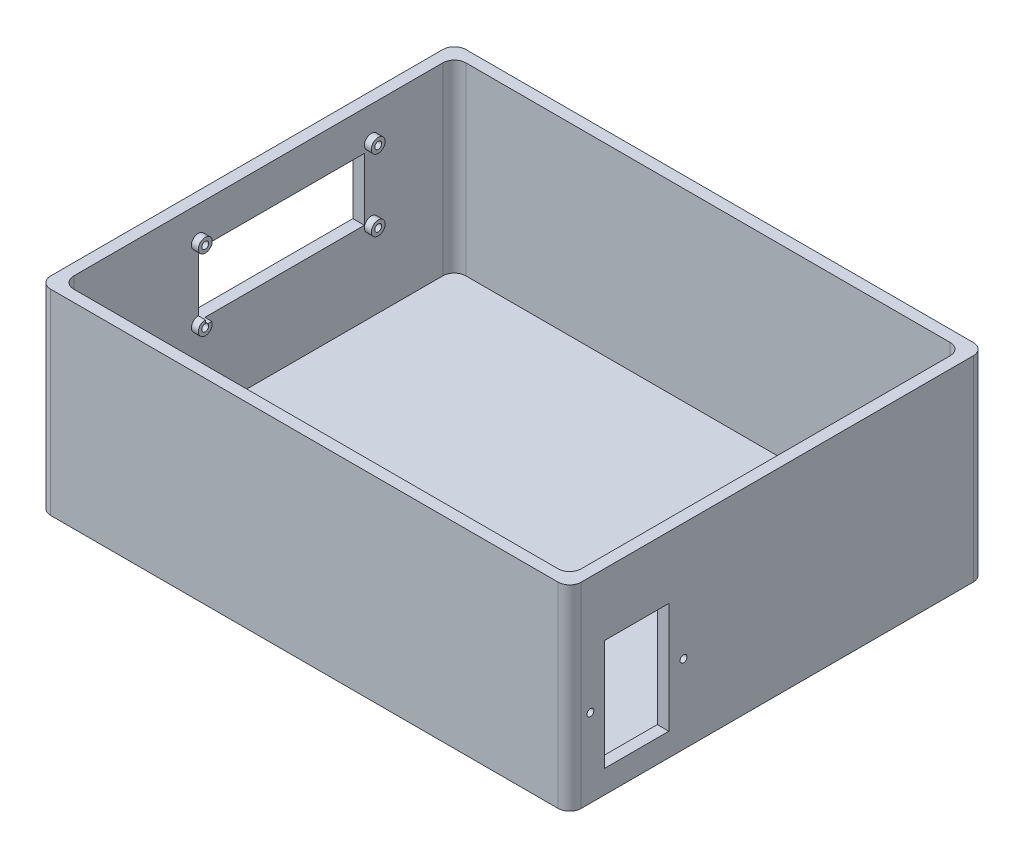
from build123d import *

# Parameters (mm, degrees)
SKETCH1_W           = 230
SKETCH1_H           = 180
BOSS_EXTRUDE1_DEPTH = 5
SKETCH2_W           = 230
SKETCH2_H           = 180
SKETCH2_W_2         = 220
SKETCH2_H_2         = 170
BOSS_EXTRUDE2_DEPTH = 80
FILLET1_R           = 5
SKETCH3_W           = 28
SKETCH3_H           = 48
CUT_EXTRUDE1_DEPTH  = 5
SKETCH4_R           = 1.5
CUT_EXTRUDE2_DEPTH  = 5
SKETCH7_R           = 3
BOSS_EXTRUDE3_DEPTH = 3
SKETCH5_W           = 72
SKETCH5_H           = 27
CUT_EXTRUDE3_DEPTH  = 10
SKETCH8_R           = 1.5
CUT_EXTRUDE4_DEPTH  = 5


with BuildPart() as part:
    # Sketch1 → Boss-Extrude1 (new body)
    with BuildSketch(Plane(origin=(0, 0, 0), x_dir=(1, 0, 0), z_dir=(0, 1, 0))):
        with Locations((115, 90)):
            Rectangle(SKETCH1_W, SKETCH1_H)
    extrude(amount=BOSS_EXTRUDE1_DEPTH)

    # Sketch2 → Boss-Extrude2 (add)
    with BuildSketch(Plane(origin=(0, 5, 0), x_dir=(1, 0, 0), z_dir=(0, 1, 0))):
        with Locations((115, 90)):
            Rectangle(SKETCH2_W, SKETCH2_H)
        with Locations((115, 90)):
            Rectangle(SKETCH2_W_2, SKETCH2_H_2, mode=Mode.SUBTRACT)
    extrude(amount=BOSS_EXTRUDE2_DEPTH)

    # Fillet1
    fillet1_edges = [part.edges().sort_by_distance(p)[0] for p in [
        (225, 45, -5),
        (225, 45, -175),
        (5, 45, -175),
        (5, 45, -5),
        (0, 42.5, -180),
        (230, 42.5, -180),
        (230, 42.5, 0),
        (0, 42.5, 0),
    ]]
    fillet(fillet1_edges, radius=FILLET1_R)

    # Sketch3 → Cut-Extrude1 (cut)
    with BuildSketch(Plane(origin=(230, 0, 0), x_dir=(0, 0, -1), z_dir=(1, 0, 0))):
        with Locations((29, 34)):
            Rectangle(SKETCH3_W, SKETCH3_H)
    extrude(amount=-CUT_EXTRUDE1_DEPTH, mode=Mode.SUBTRACT)

    # Sketch4 → Cut-Extrude2 (cut)
    with BuildSketch(Plane(origin=(230, 0, 0), x_dir=(0, 0, -1), z_dir=(1, 0, 0))):
        with Locations((9, 34)):
            Circle(SKETCH4_R)
        with Locations((49.4, 34)):
            Circle(SKETCH4_R)
    extrude(amount=-CUT_EXTRUDE2_DEPTH, mode=Mode.SUBTRACT)

    # Sketch7 → Boss-Extrude3 (add)
    with BuildSketch(Plane(origin=(5, 0, 0), x_dir=(0, 0, -1), z_dir=(1, 0, 0))):
        with Locations((139, 40)):
            Circle(SKETCH7_R)
        with Locations((139, 71)):
            Circle(SKETCH7_R)
        with Locations((64, 71)):
            Circle(SKETCH7_R)
        with Locations((64, 40)):
            Circle(SKETCH7_R)
    extrude(amount=BOSS_EXTRUDE3_DEPTH)

    # Sketch5 → Cut-Extrude3 (cut)
    with BuildSketch(Plane.ZY):
        with Locations((-100, 54.5)):
            Rectangle(SKETCH5_W, SKETCH5_H)
    extrude(amount=-CUT_EXTRUDE3_DEPTH, mode=Mode.SUBTRACT)

    # Sketch8 → Cut-Extrude4 (cut)
    with BuildSketch(Plane(origin=(8, 0, 0), x_dir=(0, 0, -1), z_dir=(1, 0, 0))):
        with Locations((64, 40)):
            Circle(SKETCH8_R)
        with Locations((139, 40)):
            Circle(SKETCH8_R)
        with Locations((139, 71)):
            Circle(SKETCH8_R)
        with Locations((64, 71)):
            Circle(SKETCH8_R)
    extrude(amount=-CUT_EXTRUDE4_DEPTH, mode=Mode.SUBTRACT)


solid = part.part
